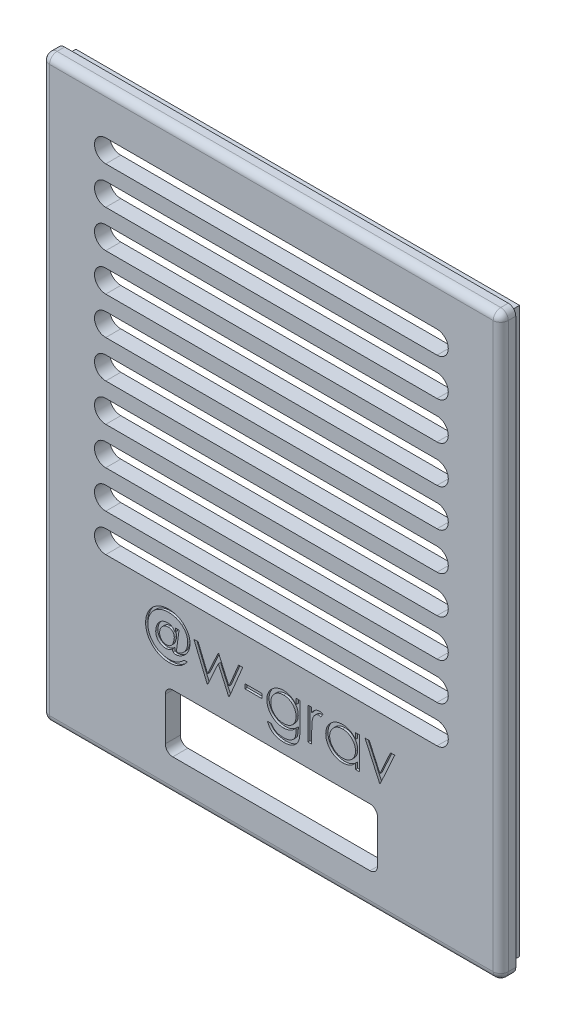
from build123d import *

# Parameters (mm, degrees)
SKETCH_1_W           = 59
SKETCH_1_H           = 75
EXTRUDE_1_DEPTH      = 2
SKETCH_2_W           = 61
SKETCH_2_H           = 77
SKETCH_2_W_2         = 59
SKETCH_2_H_2         = 75
EXTRUDE_1_2_DEPTH    = 2
FILLET_1_R           = 1
EXTRUDE_2_DEPTH      = 1.5
EXTRUDE_2_DEPTH_BACK = 1
SKETCH_5_W           = 59
SKETCH_5_H           = 75
SKETCH_5_W_2         = 58.2
SKETCH_5_H_2         = 74.2
FILLET_2_R           = 1
CUT_EXTRUDE_1_REACH  = 51.158
SKETCH_7_W           = 2.238782052
SKETCH_7_H           = 0.597008547
CUT_EXTRUDE_2_DEPTH  = 0.3


with BuildPart() as part:
    # Эскиз1 → Extrude 1 (new body)
    with BuildSketch(Plane.XY):
        Rectangle(SKETCH_1_W, SKETCH_1_H)
    extrude(amount=EXTRUDE_1_DEPTH)

    # Эскиз2 → Extrude 1 2 (add)
    with BuildSketch(Plane.XY.offset(2)):
        Rectangle(SKETCH_2_W, SKETCH_2_H)
        Rectangle(SKETCH_2_W_2, SKETCH_2_H_2, mode=Mode.SUBTRACT)
    extrude(amount=-EXTRUDE_1_2_DEPTH)

    # Скругление1
    fillet_1_edges = [part.edges().sort_by_distance(p)[0] for p in [
        (30.5, 38.5, 1),
        (30.5, -38.5, 1),
        (-30.5, -38.5, 1),
        (-30.5, 38.5, 1),
    ]]
    fillet(fillet_1_edges, radius=FILLET_1_R)

    # Эскиз5 → Вытянуть-Тонкостенный2 (add, two sides: drawn at the far end of the back side and taken through both)
    with BuildSketch(Plane(origin=(0, 0, 0), x_dir=(-1, 0, 0), z_dir=(0, 0, -1)).offset(-EXTRUDE_2_DEPTH_BACK)):
        Rectangle(SKETCH_5_W, SKETCH_5_H)
        Rectangle(SKETCH_5_W_2, SKETCH_5_H_2, mode=Mode.SUBTRACT)
    extrude(amount=EXTRUDE_2_DEPTH + EXTRUDE_2_DEPTH_BACK)

    # Скругление2
    fillet_2_edges = [part.edges().sort_by_distance(p)[0] for p in [
        (-30.5, 0, 2),
        (30.5, 0, 2),
        (0, 38.5, 2),
        (0, -38.5, 2),
        (-30.207106781, 38.207106781, 2),
        (30.207106781, 38.207106781, 2),
        (30.207106781, -38.207106781, 2),
        (-30.207106781, -38.207106781, 2),
    ]]
    fillet(fillet_2_edges, radius=FILLET_2_R)

    # Эскиз6 → Вырез-Вытянуть1 (cut, up to next)
    with BuildSketch(Plane(origin=(0, 0, 0), x_dir=(-1, 0, 0), z_dir=(0, 0, -1)), mode=Mode.PRIVATE) as cut_extrude_1_sk1:
        with BuildLine():
            Line((-22.027798739, 32.774370454), (22.027798739, 32.774370454))
            ThreePointArc((22.027798739, 32.774370454), (23.524833605, 31.277335588), (22.027798739, 29.780300723))
            Line((22.027798739, 29.780300723), (-22.027798739, 29.780300723))
            ThreePointArc((-22.027798739, 29.780300723), (-23.524833605, 31.277335588), (-22.027798739, 32.774370454))
        make_face()
    cut_extrude_1_tool1 = extrude(cut_extrude_1_sk1.sketch, amount=-CUT_EXTRUDE_1_REACH, mode=Mode.PRIVATE) & part.part
    # Эскиз6 → Вырез-Вытянуть1 (cut, up to next)
    with BuildSketch(Plane(origin=(0, 0, 0), x_dir=(-1, 0, 0), z_dir=(0, 0, -1)), mode=Mode.PRIVATE) as cut_extrude_1_sk2:
        with BuildLine():
            Line((-22.027798739, 27.774370454), (22.027798739, 27.774370454))
            ThreePointArc((22.027798739, 27.774370454), (23.524833605, 26.277335588), (22.027798739, 24.780300723))
            Line((22.027798739, 24.780300723), (-22.027798739, 24.780300723))
            ThreePointArc((-22.027798739, 24.780300723), (-23.524833605, 26.277335588), (-22.027798739, 27.774370454))
        make_face()
    cut_extrude_1_tool2 = extrude(cut_extrude_1_sk2.sketch, amount=-CUT_EXTRUDE_1_REACH, mode=Mode.PRIVATE) & part.part
    # Эскиз6 → Вырез-Вытянуть1 (cut, up to next)
    with BuildSketch(Plane(origin=(0, 0, 0), x_dir=(-1, 0, 0), z_dir=(0, 0, -1)), mode=Mode.PRIVATE) as cut_extrude_1_sk3:
        with BuildLine():
            Line((-22.027798739, 22.774370454), (22.027798739, 22.774370454))
            ThreePointArc((22.027798739, 22.774370454), (23.524833605, 21.277335588), (22.027798739, 19.780300723))
            Line((22.027798739, 19.780300723), (-22.027798739, 19.780300723))
            ThreePointArc((-22.027798739, 19.780300723), (-23.524833605, 21.277335588), (-22.027798739, 22.774370454))
        make_face()
    cut_extrude_1_tool3 = extrude(cut_extrude_1_sk3.sketch, amount=-CUT_EXTRUDE_1_REACH, mode=Mode.PRIVATE) & part.part
    # Эскиз6 → Вырез-Вытянуть1 (cut, up to next)
    with BuildSketch(Plane(origin=(0, 0, 0), x_dir=(-1, 0, 0), z_dir=(0, 0, -1)), mode=Mode.PRIVATE) as cut_extrude_1_sk4:
        with BuildLine():
            Line((-22.027798739, 17.774370454), (22.027798739, 17.774370454))
            ThreePointArc((22.027798739, 17.774370454), (23.524833605, 16.277335588), (22.027798739, 14.780300723))
            Line((22.027798739, 14.780300723), (-22.027798739, 14.780300723))
            ThreePointArc((-22.027798739, 14.780300723), (-23.524833605, 16.277335588), (-22.027798739, 17.774370454))
        make_face()
    cut_extrude_1_tool4 = extrude(cut_extrude_1_sk4.sketch, amount=-CUT_EXTRUDE_1_REACH, mode=Mode.PRIVATE) & part.part
    # Эскиз6 → Вырез-Вытянуть1 (cut, up to next)
    with BuildSketch(Plane(origin=(0, 0, 0), x_dir=(-1, 0, 0), z_dir=(0, 0, -1)), mode=Mode.PRIVATE) as cut_extrude_1_sk5:
        with BuildLine():
            Line((-22.027798739, 12.774370454), (22.027798739, 12.774370454))
            ThreePointArc((22.027798739, 12.774370454), (23.524833605, 11.277335588), (22.027798739, 9.780300723))
            Line((22.027798739, 9.780300723), (-22.027798739, 9.780300723))
            ThreePointArc((-22.027798739, 9.780300723), (-23.524833605, 11.277335588), (-22.027798739, 12.774370454))
        make_face()
    cut_extrude_1_tool5 = extrude(cut_extrude_1_sk5.sketch, amount=-CUT_EXTRUDE_1_REACH, mode=Mode.PRIVATE) & part.part
    # Эскиз6 → Вырез-Вытянуть1 (cut, up to next)
    with BuildSketch(Plane(origin=(0, 0, 0), x_dir=(-1, 0, 0), z_dir=(0, 0, -1)), mode=Mode.PRIVATE) as cut_extrude_1_sk6:
        with BuildLine():
            Line((-22.027798739, 7.774370454), (22.027798739, 7.774370454))
            ThreePointArc((22.027798739, 7.774370454), (23.524833605, 6.277335588), (22.027798739, 4.780300723))
            Line((22.027798739, 4.780300723), (-22.027798739, 4.780300723))
            ThreePointArc((-22.027798739, 4.780300723), (-23.524833605, 6.277335588), (-22.027798739, 7.774370454))
        make_face()
    cut_extrude_1_tool6 = extrude(cut_extrude_1_sk6.sketch, amount=-CUT_EXTRUDE_1_REACH, mode=Mode.PRIVATE) & part.part
    # Эскиз6 → Вырез-Вытянуть1 (cut, up to next)
    with BuildSketch(Plane(origin=(0, 0, 0), x_dir=(-1, 0, 0), z_dir=(0, 0, -1)), mode=Mode.PRIVATE) as cut_extrude_1_sk7:
        with BuildLine():
            Line((-22.027798739, 2.774370454), (22.027798739, 2.774370454))
            ThreePointArc((22.027798739, 2.774370454), (23.524833605, 1.277335588), (22.027798739, -0.219699277))
            Line((22.027798739, -0.219699277), (-22.027798739, -0.219699277))
            ThreePointArc((-22.027798739, -0.219699277), (-23.524833605, 1.277335588), (-22.027798739, 2.774370454))
        make_face()
    cut_extrude_1_tool7 = extrude(cut_extrude_1_sk7.sketch, amount=-CUT_EXTRUDE_1_REACH, mode=Mode.PRIVATE) & part.part
    # Эскиз6 → Вырез-Вытянуть1 (cut, up to next)
    with BuildSketch(Plane(origin=(0, 0, 0), x_dir=(-1, 0, 0), z_dir=(0, 0, -1)), mode=Mode.PRIVATE) as cut_extrude_1_sk8:
        with BuildLine():
            Line((-22.027798739, -2.225629546), (22.027798739, -2.225629546))
            ThreePointArc((22.027798739, -2.225629546), (23.524833605, -3.722664412), (22.027798739, -5.219699277))
            Line((22.027798739, -5.219699277), (-22.027798739, -5.219699277))
            ThreePointArc((-22.027798739, -5.219699277), (-23.524833605, -3.722664412), (-22.027798739, -2.225629546))
        make_face()
    cut_extrude_1_tool8 = extrude(cut_extrude_1_sk8.sketch, amount=-CUT_EXTRUDE_1_REACH, mode=Mode.PRIVATE) & part.part
    # Эскиз6 → Вырез-Вытянуть1 (cut, up to next)
    with BuildSketch(Plane(origin=(0, 0, 0), x_dir=(-1, 0, 0), z_dir=(0, 0, -1)), mode=Mode.PRIVATE) as cut_extrude_1_sk9:
        with BuildLine():
            Line((-22.027798739, -7.225629546), (22.027798739, -7.225629546))
            ThreePointArc((22.027798739, -7.225629546), (23.524833605, -8.722664412), (22.027798739, -10.219699277))
            Line((22.027798739, -10.219699277), (-22.027798739, -10.219699277))
            ThreePointArc((-22.027798739, -10.219699277), (-23.524833605, -8.722664412), (-22.027798739, -7.225629546))
        make_face()
    cut_extrude_1_tool9 = extrude(cut_extrude_1_sk9.sketch, amount=-CUT_EXTRUDE_1_REACH, mode=Mode.PRIVATE) & part.part
    # Эскиз6 → Вырез-Вытянуть1 (cut, up to next)
    with BuildSketch(Plane(origin=(0, 0, 0), x_dir=(-1, 0, 0), z_dir=(0, 0, -1)), mode=Mode.PRIVATE) as cut_extrude_1_sk10:
        with BuildLine():
            Line((-22.027798739, -12.225629546), (22.027798739, -12.225629546))
            ThreePointArc((22.027798739, -12.225629546), (23.524833605, -13.722664412), (22.027798739, -15.219699277))
            Line((22.027798739, -15.219699277), (-22.027798739, -15.219699277))
            ThreePointArc((-22.027798739, -15.219699277), (-23.524833605, -13.722664412), (-22.027798739, -12.225629546))
        make_face()
    cut_extrude_1_tool10 = extrude(cut_extrude_1_sk10.sketch, amount=-CUT_EXTRUDE_1_REACH, mode=Mode.PRIVATE) & part.part
    # Эскиз6 → Вырез-Вытянуть1 (cut, up to next)
    with BuildSketch(Plane(origin=(0, 0, 0), x_dir=(-1, 0, 0), z_dir=(0, 0, -1)), mode=Mode.PRIVATE) as cut_extrude_1_sk11:
        with BuildLine():
            Line((-13.114900163, -34.057543196), (13.114900163, -34.057543196))
            ThreePointArc((13.114900163, -34.057543196), (13.822006944, -33.764649977), (14.114900163, -33.057543196))
            Line((14.114900163, -33.057543196), (14.114900163, -27.358506744))
            ThreePointArc((14.114900163, -27.358506744), (13.822006944, -26.651399962), (13.114900163, -26.358506744))
            Line((13.114900163, -26.358506744), (-13.114900163, -26.358506744))
            ThreePointArc((-13.114900163, -26.358506744), (-13.822006944, -26.651399962), (-14.114900163, -27.358506744))
            Line((-14.114900163, -27.358506744), (-14.114900163, -33.057543196))
            ThreePointArc((-14.114900163, -33.057543196), (-13.822006944, -33.764649977), (-13.114900163, -34.057543196))
        make_face()
    cut_extrude_1_tool11 = extrude(cut_extrude_1_sk11.sketch, amount=-CUT_EXTRUDE_1_REACH, mode=Mode.PRIVATE) & part.part
    add(cut_extrude_1_tool1.solids().sort_by_distance((0, 31.277336, 0))[0], mode=Mode.SUBTRACT)
    add(cut_extrude_1_tool2.solids().sort_by_distance((0, 26.277336, 0))[0], mode=Mode.SUBTRACT)
    add(cut_extrude_1_tool3.solids().sort_by_distance((0, 21.277336, 0))[0], mode=Mode.SUBTRACT)
    add(cut_extrude_1_tool4.solids().sort_by_distance((0, 16.277336, 0))[0], mode=Mode.SUBTRACT)
    add(cut_extrude_1_tool5.solids().sort_by_distance((0, 11.277336, 0))[0], mode=Mode.SUBTRACT)
    add(cut_extrude_1_tool6.solids().sort_by_distance((0, 6.277336, 0))[0], mode=Mode.SUBTRACT)
    add(cut_extrude_1_tool7.solids().sort_by_distance((0, 1.277336, 0))[0], mode=Mode.SUBTRACT)
    add(cut_extrude_1_tool8.solids().sort_by_distance((0, -3.722664, 0))[0], mode=Mode.SUBTRACT)
    add(cut_extrude_1_tool9.solids().sort_by_distance((0, -8.722664, 0))[0], mode=Mode.SUBTRACT)
    add(cut_extrude_1_tool10.solids().sort_by_distance((0, -13.722664, 0))[0], mode=Mode.SUBTRACT)
    add(cut_extrude_1_tool11.solids().sort_by_distance((0, -30.208025, 0))[0], mode=Mode.SUBTRACT)

    # Эскиз7 → Вырез-Вытянуть2 (cut)
    # profile 1 of 7: a face of its own
    with BuildSketch(Plane.XY.offset(2)):
        with BuildLine():
            Line((-11.587119044, -22.170419918), (-11.169679474, -22.170419918))
            add(Edge.make_bspline(
                [(-11.169679474, -22.170419918), (-11.212860723, -22.222417441), (-11.297021828, -22.323761636), (-11.425661244, -22.466598512), (-11.549729907, -22.599572254), (-11.673909454, -22.717692179), (-11.793453843, -22.826370905), (-11.912810805, -22.920039979), (-12.027986482, -23.004156283), (-12.106451637, -23.052048416), (-12.144482492, -23.075260997)],
                knots=[0, 0, 0, 0, 1.213390222, 2.364921437, 3.45091939, 4.477489221, 5.441250277, 6.350193595, 7.200364195, 8, 8, 8, 8], degree=3))
            add(Edge.make_bspline(
                [(-12.144482492, -23.075260997), (-12.19808513, -23.104492219), (-12.305350173, -23.162987255), (-12.474041681, -23.235342224), (-12.647242443, -23.299441331), (-12.826695009, -23.350146156), (-13.011285179, -23.390060455), (-13.201430432, -23.417589663), (-13.396833178, -23.435857412), (-13.529298391, -23.437987431), (-13.596192729, -23.43906308)],
                knots=[0, 0, 0, 0, 0.967652149, 1.936383228, 2.907366375, 3.894489712, 4.890576983, 5.899923271, 6.939470695, 8, 8, 8, 8], degree=3))
            add(Edge.make_bspline(
                [(-13.596192729, -23.43906308), (-13.667375097, -23.438184518), (-13.808471145, -23.436443051), (-14.017463421, -23.415176078), (-14.222449898, -23.384426399), (-14.423153861, -23.339342375), (-14.620776699, -23.284311699), (-14.81308137, -23.21344821), (-15.001725482, -23.131734828), (-15.185356291, -23.037756468), (-15.36130741, -22.931865216), (-15.529358653, -22.817886217), (-15.685301679, -22.692257122), (-15.832917227, -22.559171533), (-15.970873916, -22.417275786), (-16.096989068, -22.264533548), (-16.213836692, -22.103302155), (-16.320908827, -21.933671871), (-16.416023972, -21.757034203), (-16.499046072, -21.575949988), (-16.569728343, -21.390691022), (-16.626242066, -21.201135597), (-16.671250899, -21.007647794), (-16.701848177, -20.810400078), (-16.723220151, -20.609182837), (-16.724950354, -20.473511308), (-16.725823471, -20.405046988)],
                knots=[0, 0, 0, 0, 1.054671765, 2.09054602, 3.110664614, 4.125466063, 5.137598463, 6.149074806, 7.160485519, 8.183382118, 9.204004889, 10.202734905, 11.190638985, 12.169548661, 13.14737277, 14.121047053, 15.102868243, 16.097051703, 17.092036063, 18.074229033, 19.047903316, 20.028472937, 21.00393517, 21.98990556, 22.985640179, 24, 24, 24, 24], degree=3))
            add(Edge.make_bspline(
                [(-16.725823471, -20.405046988), (-16.724256426, -20.335830953), (-16.721134436, -20.197933378), (-16.702895794, -19.992869353), (-16.669271755, -19.791796099), (-16.625833482, -19.593910056), (-16.566725348, -19.400728319), (-16.496884045, -19.210275377), (-16.412606122, -19.024493946), (-16.31718403, -18.842457999), (-16.21065404, -18.667450519), (-16.093922852, -18.501398882), (-15.96742359, -18.345788237), (-15.832189012, -18.200207528), (-15.688450457, -18.063682238), (-15.533790218, -17.939673551), (-15.371571022, -17.822954336), (-15.198970387, -17.719044827), (-15.020479699, -17.624725456), (-14.836989274, -17.542982562), (-14.649738961, -17.473651656), (-14.457862691, -17.41799347), (-14.26209868, -17.373356389), (-14.061868418, -17.342027462), (-13.857766663, -17.322784636), (-13.720222992, -17.320749681), (-13.650996248, -17.319725474)],
                knots=[0, 0, 0, 0, 1.027058365, 2.046185658, 3.051117553, 4.050025228, 5.049781473, 6.046005589, 7.057797166, 8.07411433, 9.093779891, 10.095330734, 11.083325814, 12.066732605, 13.041716928, 14.021600531, 15.005700308, 16.004591337, 17.008016425, 17.999304607, 18.982711398, 19.968128194, 20.961410433, 21.95973534, 22.973119735, 24, 24, 24, 24], degree=3))
            add(Edge.make_bspline(
                [(-13.650996248, -17.319725474), (-13.55371721, -17.321864614), (-13.362784522, -17.326063173), (-13.082213029, -17.362151981), (-12.813281053, -17.420156741), (-12.555404315, -17.501300893), (-12.310645562, -17.609108855), (-12.075795445, -17.737037875), (-11.854195134, -17.891173832), (-11.645522878, -18.064526749), (-11.45663157, -18.254441669), (-11.287883674, -18.452278573), (-11.147897076, -18.660315794), (-11.030134493, -18.87444594), (-10.942334878, -19.098318165), (-10.877199068, -19.328554371), (-10.83755503, -19.566854663), (-10.832778752, -19.728599319), (-10.830364069, -19.810370506)],
                knots=[0, 0, 0, 0, 1.11831066, 2.194944194, 3.246979174, 4.27888224, 5.297750955, 6.317971723, 7.349497193, 8.396773963, 9.433428718, 10.426349215, 11.382158292, 12.312128617, 13.230936323, 14.140829506, 15.060082842, 16, 16, 16, 16], degree=3))
            add(Edge.make_bspline(
                [(-10.830364069, -19.810370506), (-10.831112069, -19.869488256), (-10.832586036, -19.985982365), (-10.848665734, -20.157618082), (-10.872190508, -20.323357092), (-10.908128006, -20.482783904), (-10.951183791, -20.63644503), (-11.007366094, -20.783159189), (-11.07055847, -20.92453161), (-11.145806505, -21.058391931), (-11.228650288, -21.185576021), (-11.318616652, -21.305939544), (-11.415257423, -21.419233401), (-11.51965181, -21.524913639), (-11.631743686, -21.622294104), (-11.750008306, -21.714083545), (-11.875428766, -21.798003069), (-11.963783866, -21.847242715), (-12.008056711, -21.871915645)],
                knots=[0, 0, 0, 0, 1.133597158, 2.233802705, 3.30396869, 4.342264069, 5.366329644, 6.361939563, 7.352848959, 8.334034895, 9.303853874, 10.262605972, 11.214375925, 12.158023099, 13.109033576, 14.060423866, 15.02812001, 16, 16, 16, 16], degree=3))
            add(Edge.make_bspline(
                [(-12.008056711, -21.871915645), (-12.073911063, -21.905918487), (-12.198185021, -21.97008536), (-12.383671779, -22.040575505), (-12.554286435, -22.086236969), (-12.664298568, -22.092744926), (-12.715838328, -22.09579385)],
                knots=[0, 0, 0, 0, 1.186206281, 2.23849367, 3.174749084, 4, 4, 4, 4], degree=3))
            add(Edge.make_bspline(
                [(-12.715838328, -22.09579385), (-12.749433769, -22.094364137), (-12.81410468, -22.091611952), (-12.905981348, -22.066584436), (-12.987272226, -22.024622102), (-13.031068684, -21.984139329), (-13.052821668, -21.964032198)],
                knots=[0, 0, 0, 0, 1.082052135, 2.082940295, 3.047827814, 4, 4, 4, 4], degree=3))
            add(Edge.make_bspline(
                [(-13.052821668, -21.964032198), (-13.067895628, -21.945232353), (-13.100097587, -21.90507092), (-13.128429778, -21.825516335), (-13.148696518, -21.730709935), (-13.150802463, -21.661013062), (-13.151934415, -21.623550761)],
                knots=[0, 0, 0, 0, 0.793528208, 1.695185748, 2.761154694, 4, 4, 4, 4], degree=3))
            add(Edge.make_bspline(
                [(-13.151934415, -21.623550761), (-13.176511352, -21.651444837), (-13.226288904, -21.707940849), (-13.316244655, -21.782159373), (-13.418669538, -21.849033107), (-13.53179302, -21.908827917), (-13.651854215, -21.959695685), (-13.777148284, -21.993447842), (-13.904262316, -22.017686782), (-13.990195642, -22.020002193), (-14.033454848, -22.021167781)],
                knots=[0, 0, 0, 0, 0.894537205, 1.811774761, 2.798735569, 3.837640279, 4.891504278, 5.932137932, 6.959029326, 8, 8, 8, 8], degree=3))
            add(Edge.make_bspline(
                [(-14.033454848, -22.021167781), (-14.08132937, -22.020148722), (-14.175077914, -22.018153186), (-14.312232019, -21.999523609), (-14.44354319, -21.972883596), (-14.567832395, -21.930521882), (-14.687006017, -21.880500448), (-14.798332196, -21.816110699), (-14.904543424, -21.742609773), (-15.00260389, -21.656543013), (-15.092358479, -21.561795645), (-15.169691142, -21.458206123), (-15.235752672, -21.347800973), (-15.289277109, -21.229538756), (-15.331309229, -21.104106928), (-15.3619223, -20.971424594), (-15.379283916, -20.831114614), (-15.381449042, -20.735081387), (-15.38255424, -20.686060777)],
                knots=[0, 0, 0, 0, 1.076938101, 2.1088749, 3.110935573, 4.087505955, 5.059323376, 6.01530039, 6.976387481, 7.962317429, 8.946382585, 9.908703191, 10.865920305, 11.83683164, 12.824467887, 13.83886383, 14.896837935, 16, 16, 16, 16], degree=3))
            add(Edge.make_bspline(
                [(-15.38255424, -20.686060777), (-15.381152965, -20.632360949), (-15.378371355, -20.525763782), (-15.357802822, -20.367807858), (-15.325438246, -20.213189446), (-15.278933247, -20.06232725), (-15.21682385, -19.916177346), (-15.145499754, -19.772053201), (-15.057642957, -19.632787768), (-14.959229591, -19.49759072), (-14.848310573, -19.372251154), (-14.726698509, -19.261233348), (-14.593694094, -19.168989286), (-14.451722688, -19.09201912), (-14.298618276, -19.033799994), (-14.135893904, -18.992232467), (-13.963203623, -18.965530822), (-13.844658736, -18.962864851), (-13.783923932, -18.961498978)],
                knots=[0, 0, 0, 0, 0.982156527, 1.949635761, 2.909086418, 3.86940613, 4.832039489, 5.811438195, 6.80782758, 7.84029968, 8.867740389, 9.864510254, 10.844863476, 11.821496572, 12.811854966, 13.832804459, 14.889667883, 16, 16, 16, 16], degree=3))
            add(Edge.make_bspline(
                [(-13.783923932, -18.961498978), (-13.731361127, -18.9629821), (-13.629896641, -18.965845043), (-13.484170188, -18.990070982), (-13.351907827, -19.032352164), (-13.230703202, -19.091740263), (-13.118206429, -19.17293907), (-13.010485051, -19.276990235), (-12.907012726, -19.40616752), (-12.845081598, -19.503821767), (-12.812619011, -19.555009428)],
                knots=[0, 0, 0, 0, 1.048525916, 2.024019497, 2.936514309, 3.810654959, 4.706011411, 5.693488602, 6.790990403, 8, 8, 8, 8], degree=3))
            Line((-12.812619011, -19.555009428), (-12.728664684, -19.036125046))
            Line((-12.728664684, -19.036125046), (-12.277410177, -19.036125046))
            Line((-12.277410177, -19.036125046), (-12.607397323, -21.470800527))
            add(Edge.make_bspline(
                [(-12.607397323, -21.470800527), (-12.609257413, -21.488688311), (-12.61253366, -21.520194745), (-12.617831927, -21.561291824), (-12.619920766, -21.590118686), (-12.621001805, -21.605283042), (-12.62138971, -21.610724405)],
                knots=[0, 0, 0, 0, 1.534509141, 2.702789396, 3.534527252, 4, 4, 4, 4], degree=3))
            add(Edge.make_bspline(
                [(-12.62138971, -21.610724405), (-12.618828156, -21.627145731), (-12.613470905, -21.661489397), (-12.568156086, -21.69870877), (-12.507488125, -21.719729296), (-12.46110681, -21.721632754), (-12.435990572, -21.722663508)],
                knots=[0, 0, 0, 0, 0.807623339, 1.689068618, 2.748592994, 4, 4, 4, 4], degree=3))
            add(Edge.make_bspline(
                [(-12.435990572, -21.722663508), (-12.416867557, -21.72212908), (-12.377040407, -21.721016036), (-12.31637152, -21.706429819), (-12.25119918, -21.687092369), (-12.182924412, -21.656739214), (-12.109312328, -21.62107552), (-12.031836794, -21.576172216), (-11.951120105, -21.522345421), (-11.836996938, -21.441837684), (-11.699535123, -21.326488011), (-11.553393024, -21.166183067), (-11.424304661, -20.989216317), (-11.319703943, -20.792622251), (-11.233480164, -20.58283125), (-11.173906116, -20.359809861), (-11.134525472, -20.126206687), (-11.130777418, -19.966396198), (-11.128868343, -19.884996574)],
                knots=[0, 0, 0, 0, 0.375176303, 0.781372735, 1.22132254, 1.711029584, 2.247629175, 2.82965315, 3.46978829, 4.154749159, 5.575568552, 6.987253401, 8.410496035, 9.870664801, 11.355111217, 12.860557022, 14.400921749, 16, 16, 16, 16], degree=3))
            add(Edge.make_bspline(
                [(-11.128868343, -19.884996574), (-11.130809949, -19.805933141), (-11.134629875, -19.650383303), (-11.173728093, -19.422862705), (-11.234200656, -19.205787001), (-11.318305812, -18.998500548), (-11.429497834, -18.80261964), (-11.564073334, -18.616982166), (-11.722726559, -18.441216168), (-11.843636424, -18.336433398), (-11.905445867, -18.282868169)],
                knots=[0, 0, 0, 0, 1.028181886, 2.022850771, 2.99499652, 3.956967163, 4.926424071, 5.919109875, 6.936243457, 8, 8, 8, 8], degree=3))
            add(Edge.make_bspline(
                [(-11.905445867, -18.282868169), (-11.96631552, -18.235292713), (-12.087423442, -18.140635291), (-12.285538035, -18.022282726), (-12.492256959, -17.920582203), (-12.708431039, -17.835926786), (-12.93501924, -17.771766002), (-13.171142524, -17.727082239), (-13.417060637, -17.697859803), (-13.5844472, -17.694543784), (-13.669652765, -17.692855816)],
                knots=[0, 0, 0, 0, 0.97603565, 1.941947129, 2.911228469, 3.886855723, 4.873132026, 5.884210117, 6.922989585, 8, 8, 8, 8], degree=3))
            add(Edge.make_bspline(
                [(-13.669652765, -17.692855816), (-13.733431813, -17.694022423), (-13.859255832, -17.696323918), (-14.045750878, -17.713234519), (-14.22758137, -17.739892781), (-14.405399428, -17.776825581), (-14.578457832, -17.826486296), (-14.747299354, -17.885471857), (-14.911711406, -17.955970783), (-15.070518432, -18.037228863), (-15.223084104, -18.128143095), (-15.368369732, -18.227323492), (-15.505169432, -18.336034022), (-15.633332129, -18.454114357), (-15.75415338, -18.580316831), (-15.865862487, -18.715908934), (-15.970182724, -18.859789313), (-16.065212877, -19.011737491), (-16.149877754, -19.169619329), (-16.22389403, -19.331637012), (-16.286747453, -19.496741241), (-16.338370763, -19.665364134), (-16.378049133, -19.836821473), (-16.405734042, -20.011789056), (-16.424053606, -20.189719352), (-16.426227506, -20.309775896), (-16.427319198, -20.370066019)],
                knots=[0, 0, 0, 0, 1.070829268, 2.112543943, 3.141670701, 4.15543105, 5.159481232, 6.16264015, 7.156713958, 8.160785351, 9.155822772, 10.136979681, 11.112411194, 12.087034534, 13.061045838, 14.043742668, 15.034597664, 16.043240159, 17.050614984, 18.040674398, 19.032173992, 20.014870823, 20.999581089, 21.984550855, 22.987879599, 24, 24, 24, 24], degree=3))
            add(Edge.make_bspline(
                [(-16.427319198, -20.370066019), (-16.426236616, -20.430746696), (-16.424080826, -20.551582689), (-16.405625953, -20.730644933), (-16.378430118, -20.906981849), (-16.336949406, -21.078882901), (-16.28600171, -21.247822199), (-16.222000482, -21.412454738), (-16.149614875, -21.575063023), (-16.062529214, -21.731516215), (-15.967737014, -21.883269897), (-15.862245777, -22.02650169), (-15.74949671, -22.162565095), (-15.625826248, -22.288694564), (-15.494697114, -22.407703646), (-15.353995734, -22.517382191), (-15.205408933, -22.619289238), (-15.048635823, -22.712411911), (-14.884593184, -22.794454394), (-14.716147964, -22.867238495), (-14.543706862, -22.929072068), (-14.366904619, -22.979568228), (-14.185619638, -23.017667448), (-14.000363009, -23.045874109), (-13.811040302, -23.062306176), (-13.683675952, -23.06471782), (-13.619513375, -23.065932739)],
                knots=[0, 0, 0, 0, 1.006371614, 2.004030248, 2.983500133, 3.964094175, 4.934952232, 5.908482978, 6.892484038, 7.885129491, 8.876161175, 9.858872768, 10.83385438, 11.805076354, 12.786602682, 13.769462332, 14.76204496, 15.773854901, 16.79174823, 17.802633252, 18.816249484, 19.828572904, 20.850379654, 21.887191355, 22.935626445, 24, 24, 24, 24], degree=3))
            add(Edge.make_bspline(
                [(-13.619513375, -23.065932739), (-13.526471486, -23.064041023), (-13.343878377, -23.060328565), (-13.077478733, -23.020912211), (-12.823366288, -22.962845037), (-12.621324299, -22.890661254), (-12.464182318, -22.819168417), (-12.344585821, -22.755793753), (-12.223578397, -22.681927163), (-12.099943891, -22.598961786), (-11.973645437, -22.506709922), (-11.845930314, -22.404076947), (-11.715838076, -22.291866698), (-11.630732055, -22.21156892), (-11.587119044, -22.170419918)],
                knots=[0, 0, 0, 0, 1.464360193, 2.873781725, 4.232421021, 5.564556907, 6.243952403, 6.950468897, 7.694825178, 8.475836581, 9.294975113, 10.157327564, 11.055713194, 12, 12, 12, 12], degree=3))
        make_face()
        with BuildLine():
            add(Edge.make_bspline(
                [(-13.930844004, -21.573411371), (-13.888332056, -21.571632517), (-13.803924777, -21.56810061), (-13.679360456, -21.539071619), (-13.559973119, -21.489935693), (-13.443595984, -21.425406647), (-13.336552104, -21.33919457), (-13.238294079, -21.235851404), (-13.15387323, -21.1117398), (-13.109534126, -21.019416255), (-13.086636605, -20.971738695)],
                knots=[0, 0, 0, 0, 0.92782678, 1.842195878, 2.775444063, 3.741029296, 4.738047745, 5.764976969, 6.845793398, 8, 8, 8, 8], degree=3))
            add(Edge.make_bspline(
                [(-13.086636605, -20.971738695), (-13.060355153, -20.906531049), (-13.008461076, -20.7777752), (-12.955897912, -20.578545588), (-12.920940764, -20.379076296), (-12.917129594, -20.245446607), (-12.915229855, -20.178836718)],
                knots=[0, 0, 0, 0, 1.032121943, 2.037977831, 3.02199818, 4, 4, 4, 4], degree=3))
            add(Edge.make_bspline(
                [(-12.915229855, -20.178836718), (-12.917769692, -20.124138072), (-12.922673266, -20.018533335), (-12.964797929, -19.867970174), (-13.034183779, -19.733335478), (-13.132603413, -19.618795152), (-13.25128379, -19.525071118), (-13.389160101, -19.457543855), (-13.543179236, -19.41523765), (-13.651876421, -19.411295578), (-13.708131831, -19.409255388)],
                knots=[0, 0, 0, 0, 1.056278198, 2.039318897, 2.997587872, 3.962995163, 4.937462039, 5.902313093, 6.914357928, 8, 8, 8, 8], degree=3))
            add(Edge.make_bspline(
                [(-13.708131831, -19.409255388), (-13.746673497, -19.410408986), (-13.822551449, -19.412680103), (-13.934219616, -19.429700757), (-14.042271862, -19.456170159), (-14.146136314, -19.494937115), (-14.245914768, -19.544524676), (-14.342199382, -19.603852392), (-14.433156693, -19.676013439), (-14.519953402, -19.75689837), (-14.599890727, -19.845368319), (-14.669080327, -19.941154938), (-14.729348657, -20.041231577), (-14.776793006, -20.148041404), (-14.814484988, -20.259635164), (-14.841546556, -20.376741794), (-14.856289843, -20.499507765), (-14.858864559, -20.58302485), (-14.860171762, -20.625427096)],
                knots=[0, 0, 0, 0, 0.991843502, 1.952667371, 2.901538142, 3.851305344, 4.799965068, 5.76619212, 6.756975177, 7.783491418, 8.818022694, 9.820708532, 10.82114524, 11.819829123, 12.822864372, 13.849575656, 14.908213521, 16, 16, 16, 16], degree=3))
            add(Edge.make_bspline(
                [(-14.860171762, -20.625427096), (-14.859769597, -20.66084967), (-14.858984475, -20.730002927), (-14.845033288, -20.830468683), (-14.826117003, -20.9260728), (-14.796623769, -21.015273888), (-14.76029785, -21.099424074), (-14.715550693, -21.177848261), (-14.663574509, -21.251617451), (-14.601998047, -21.317981293), (-14.53548298, -21.378618591), (-14.46216815, -21.429512641), (-14.386031753, -21.475025402), (-14.30402923, -21.510801569), (-14.217342526, -21.539087203), (-14.125812462, -21.55824745), (-14.02999204, -21.57217383), (-13.964323625, -21.572993487), (-13.930844004, -21.573411371)],
                knots=[0, 0, 0, 0, 1.13569322, 2.217142219, 3.24949719, 4.259300957, 5.225644976, 6.186418313, 7.152118103, 8.114509449, 9.086152063, 10.034456292, 10.973610689, 11.928536492, 12.898897255, 13.894659664, 14.926637794, 16, 16, 16, 16], degree=3))
        make_face(mode=Mode.SUBTRACT)
    # profile 2 of 7: a face of its own
    with BuildSketch(Plane.XY.offset(2)):
        Polygon((-10.307981591, -19.110751115), (-9.747120046, -19.110751115), (-8.479642916, -22.170419918), (-7.090898424, -19.110751115), (-7.002279968, -19.110751115), (-5.643852317, -22.170419918), (-4.364714864, -19.110751115), (-3.815513642, -19.110751115), (-5.593712928, -23.364437012), (-5.702153933, -23.364437012), (-7.061747616, -20.304768209), (-8.449326075, -23.364437012), (-8.546106758, -23.364437012), align=None)
    # profile 3 of 7: a face of its own
    with BuildSketch(Plane.XY.offset(2)):
        with Locations((-2.397618343, -21.125654961)):
            Rectangle(SKETCH_7_W, SKETCH_7_H)
    # profile 4 of 7: a face of its own
    with BuildSketch(Plane.XY.offset(2)):
        with BuildLine():
            Line((3.273962854, -19.110751115), (3.796345332, -19.110751115))
            Line((3.796345332, -19.110751115), (3.796345332, -22.486414676))
            add(Edge.make_bspline(
                [(3.796345332, -22.486414676), (3.795884584, -22.558322914), (3.794995229, -22.697123134), (3.788590697, -22.897822606), (3.775085238, -23.083201322), (3.759770323, -23.254104745), (3.737739773, -23.409740707), (3.710836933, -23.550573615), (3.680509262, -23.676738618), (3.653866115, -23.754446479), (3.641263034, -23.791204841)],
                knots=[0, 0, 0, 0, 1.307562039, 2.523909702, 3.650326591, 4.686913197, 5.643429486, 6.506965704, 7.293745905, 8, 8, 8, 8], degree=3))
            add(Edge.make_bspline(
                [(3.641263034, -23.791204841), (3.622654264, -23.838985436), (3.585993115, -23.933118019), (3.517331175, -24.066555336), (3.44043979, -24.192196177), (3.352617134, -24.309340367), (3.254260345, -24.417399834), (3.14768672, -24.518722247), (3.0308207, -24.611164011), (2.903729103, -24.693130155), (2.769341639, -24.766950053), (2.627735563, -24.830890356), (2.479709379, -24.886582166), (2.323872546, -24.928297244), (2.162668335, -24.964444155), (1.994201059, -24.987968114), (1.819454991, -25.003978829), (1.70063452, -25.005459371), (1.640351576, -25.006210516)],
                knots=[0, 0, 0, 0, 0.981931301, 1.934503488, 2.87077864, 3.801706999, 4.735015492, 5.667491629, 6.616593066, 7.585388521, 8.561939025, 9.551802639, 10.560317337, 11.588439944, 12.640189604, 13.723962949, 14.845264515, 16, 16, 16, 16], degree=3))
            add(Edge.make_bspline(
                [(1.640351576, -25.006210516), (1.552399225, -25.004786099), (1.380604655, -25.002003829), (1.130134209, -24.969588581), (0.892253847, -24.923763034), (0.670106804, -24.854402936), (0.465096893, -24.769523561), (0.27862421, -24.672074574), (0.112362737, -24.560332355), (-0.037521514, -24.43310457), (-0.172800326, -24.281823304), (-0.300072497, -24.103541417), (-0.422577659, -23.895543269), (-0.494371215, -23.742883245), (-0.531966634, -23.662941286)],
                knots=[0, 0, 0, 0, 1.157897085, 2.2616841, 3.32207898, 4.345638746, 5.321241055, 6.241986252, 7.112515963, 7.955008012, 8.825025602, 9.77857164, 10.836726669, 12, 12, 12, 12], degree=3))
            Line((-0.531966634, -23.662941286), (-0.009584155, -23.662941286))
            add(Edge.make_bspline(
                [(-0.009584155, -23.662941286), (0.032429305, -23.729641177), (0.114560446, -23.86003125), (0.268144765, -24.028857296), (0.436460524, -24.173136404), (0.625188045, -24.28940468), (0.8351126, -24.377066083), (1.066360481, -24.439557379), (1.320813424, -24.476970813), (1.497963358, -24.481479954), (1.590212186, -24.483828038)],
                knots=[0, 0, 0, 0, 0.997731894, 1.950442991, 2.880492273, 3.800895997, 4.748200782, 5.754801363, 6.83083817, 8, 8, 8, 8], degree=3))
            add(Edge.make_bspline(
                [(1.590212186, -24.483828038), (1.68129474, -24.481449564), (1.856892789, -24.476864105), (2.109402483, -24.439540682), (2.339899064, -24.377052483), (2.547054541, -24.289559726), (2.72842467, -24.182372562), (2.884775565, -24.062629581), (3.011411414, -23.927617842), (3.096583455, -23.803248576), (3.149527456, -23.692446303), (3.183242116, -23.597063474), (3.210639896, -23.489206962), (3.233557078, -23.369238363), (3.25246799, -23.236986274), (3.264447069, -23.092148301), (3.27310483, -22.935053619), (3.273670232, -22.826132292), (3.273962854, -22.76976053)],
                knots=[0, 0, 0, 0, 1.570740765, 3.028230971, 4.391408896, 5.680370741, 6.894727393, 8.017376726, 9.065722033, 10.075533815, 10.603371122, 11.180248986, 11.817768598, 12.521299649, 13.286540596, 14.121245857, 15.027658897, 16, 16, 16, 16], degree=3))
            Line((3.273962854, -22.76976053), (3.273962854, -22.549380422))
            add(Edge.make_bspline(
                [(3.273962854, -22.549380422), (3.220941519, -22.612481252), (3.115831479, -22.737572989), (2.934309079, -22.901490377), (2.736039994, -23.042664097), (2.52136177, -23.158446516), (2.295532991, -23.251050028), (2.060999591, -23.315815881), (1.819863994, -23.357659191), (1.656461312, -23.362161715), (1.573887733, -23.364437012)],
                knots=[0, 0, 0, 0, 1.012485704, 2.007162095, 2.997754123, 3.998611389, 4.999708251, 5.992315798, 6.98544096, 8, 8, 8, 8], degree=3))
            add(Edge.make_bspline(
                [(1.573887733, -23.364437012), (1.525265033, -23.363580474), (1.428595032, -23.361877534), (1.284978863, -23.346978234), (1.143481991, -23.325360088), (1.004434417, -23.293625837), (0.867635499, -23.252893764), (0.733311301, -23.201975211), (0.600374234, -23.144406973), (0.471240713, -23.076597918), (0.347196874, -23.001156081), (0.229178339, -22.919433426), (0.11780328, -22.831857677), (0.014131762, -22.737565267), (-0.081700229, -22.636692665), (-0.170981614, -22.530315185), (-0.252236036, -22.416947402), (-0.327130851, -22.298656498), (-0.392087277, -22.17465458), (-0.449105452, -22.047630533), (-0.498681332, -21.917855962), (-0.538205458, -21.784896382), (-0.568392488, -21.648835619), (-0.590861283, -21.50989657), (-0.603605468, -21.36765139), (-0.60559274, -21.271821598), (-0.606592702, -21.223601676)],
                knots=[0, 0, 0, 0, 1.028754217, 2.045334182, 3.052854819, 4.056607503, 5.061168794, 6.071104265, 7.095078842, 8.125279047, 9.155117945, 10.165957491, 11.161587969, 12.151493252, 13.128948131, 14.104219989, 15.088194871, 16.07871515, 17.064853787, 18.047899887, 19.02414258, 20.002704429, 20.980574569, 21.971845993, 22.979467364, 24, 24, 24, 24], degree=3))
            add(Edge.make_bspline(
                [(-0.606592702, -21.223601676), (-0.605729279, -21.175366765), (-0.604005777, -21.079083764), (-0.589119446, -20.936258167), (-0.567884731, -20.795345047), (-0.534277287, -20.657796856), (-0.493826615, -20.52204712), (-0.443728245, -20.389098528), (-0.383492999, -20.258910586), (-0.31528988, -20.131386885), (-0.238647645, -20.00823865), (-0.154607316, -19.89127874), (-0.063067437, -19.781367816), (0.034709118, -19.677397052), (0.139916218, -19.580369593), (0.252499437, -19.490520931), (0.371349013, -19.406344985), (0.496833291, -19.32965744), (0.627016043, -19.26183268), (0.758589857, -19.199944587), (0.893297636, -19.150826533), (1.028627918, -19.107547641), (1.166964039, -19.076888156), (1.306609811, -19.053235213), (1.448043318, -19.038824957), (1.542761407, -19.037026178), (1.590212186, -19.036125046)],
                knots=[0, 0, 0, 0, 1.008818848, 2.013730394, 3.001654427, 3.987803273, 4.973046549, 5.963777569, 6.957074694, 7.972068341, 8.987420212, 9.989399531, 10.982630087, 11.977756091, 12.973280677, 13.973972381, 14.989194003, 16.018387222, 17.047741039, 18.059210846, 19.057554164, 20.045176975, 21.029480261, 22.018708529, 23.007435371, 24, 24, 24, 24], degree=3))
            add(Edge.make_bspline(
                [(1.590212186, -19.036125046), (1.668462378, -19.038381323), (1.822982465, -19.042836777), (2.050379144, -19.077796944), (2.269811655, -19.13353394), (2.482518236, -19.213388506), (2.690231598, -19.322404463), (2.892267161, -19.466001008), (3.089209459, -19.64546618), (3.210744851, -19.783092075), (3.273962854, -19.854679734)],
                knots=[0, 0, 0, 0, 0.96728863, 1.910097829, 2.838038873, 3.762875196, 4.71315279, 5.730631239, 6.819562287, 8, 8, 8, 8], degree=3))
            Line((3.273962854, -19.854679734), (3.273962854, -19.110751115))
        make_face()
        with BuildLine():
            add(Edge.make_bspline(
                [(1.632189349, -19.558507525), (1.555802214, -19.561103726), (1.404571885, -19.566243652), (1.182900677, -19.610123943), (0.968898682, -19.678886112), (0.766657273, -19.777245915), (0.577218901, -19.897145498), (0.409121849, -20.042400715), (0.262096054, -20.20828814), (0.137724905, -20.393307896), (0.038718573, -20.592916371), (-0.031369947, -20.80331577), (-0.076689331, -21.021106395), (-0.081691343, -21.169741546), (-0.084210223, -21.244590257)],
                knots=[0, 0, 0, 0, 1.026226791, 2.031711442, 3.026614839, 4.04107745, 5.047145931, 6.032893242, 7.017642609, 8.019221815, 9.021877557, 10.003543541, 10.994637589, 12, 12, 12, 12], degree=3))
            add(Edge.make_bspline(
                [(-0.084210223, -21.244590257), (-0.083003221, -21.301024521), (-0.080629399, -21.412014215), (-0.057805782, -21.574894262), (-0.020916725, -21.730028307), (0.031366343, -21.877425735), (0.096148385, -22.017931995), (0.177627364, -22.150579198), (0.27350642, -22.275485477), (0.383035108, -22.39172699), (0.503736543, -22.497601243), (0.634654069, -22.590631532), (0.775610121, -22.666719338), (0.923137995, -22.732479517), (1.080817311, -22.780508157), (1.246376922, -22.817160746), (1.420988113, -22.838130311), (1.540018732, -22.840729392), (1.600706477, -22.842054533)],
                knots=[0, 0, 0, 0, 1.039728707, 2.044842319, 3.024901384, 3.974314358, 4.923051295, 5.871625912, 6.837440708, 7.820715446, 8.810779094, 9.792721783, 10.773906224, 11.758876063, 12.764959493, 13.806266761, 14.881525401, 16, 16, 16, 16], degree=3))
            add(Edge.make_bspline(
                [(1.600706477, -22.842054533), (1.662180727, -22.840777927), (1.782392972, -22.838281535), (1.957967494, -22.816821788), (2.124331468, -22.782192859), (2.281332352, -22.733026732), (2.429562935, -22.670291868), (2.56735805, -22.590901327), (2.697672285, -22.500488099), (2.81634479, -22.39502788), (2.923654623, -22.278802478), (3.017171743, -22.152332575), (3.096858035, -22.017521212), (3.162845779, -21.874383584), (3.213222937, -21.721807314), (3.247015211, -21.560173822), (3.270642381, -21.390257479), (3.272839205, -21.273826483), (3.273962854, -21.214273417)],
                knots=[0, 0, 0, 0, 1.121943988, 2.193949579, 3.223793937, 4.220241907, 5.192961521, 6.155822191, 7.11847367, 8.083710714, 9.04790392, 10.001595906, 10.949595423, 11.902125208, 12.873731292, 13.87582262, 14.913508608, 16, 16, 16, 16], degree=3))
            add(Edge.make_bspline(
                [(3.273962854, -21.214273417), (3.271735024, -21.136743486), (3.267382628, -20.985277245), (3.226308903, -20.764573251), (3.160084101, -20.557071064), (3.067205633, -20.363426947), (2.950818888, -20.185692708), (2.810635179, -20.027160076), (2.649072078, -19.887624961), (2.466593775, -19.771377608), (2.270269632, -19.677470213), (2.064842119, -19.607018552), (1.85061622, -19.567113721), (1.705417346, -19.561392767), (1.632189349, -19.558507525)],
                knots=[0, 0, 0, 0, 1.070913519, 2.092188694, 3.091357305, 4.074328408, 5.051968682, 6.018948707, 6.99050112, 7.9935919, 9.000589572, 9.992915277, 10.987769056, 12, 12, 12, 12], degree=3))
        make_face(mode=Mode.SUBTRACT)
    # profile 5 of 7: a face of its own
    with BuildSketch(Plane.XY.offset(2)):
        with BuildLine():
            Line((4.84111029, -19.110751115), (5.363492768, -19.110751115))
            Line((5.363492768, -19.110751115), (5.363492768, -19.73691047))
            add(Edge.make_bspline(
                [(5.363492768, -19.73691047), (5.402057882, -19.678609288), (5.475813364, -19.567108733), (5.598404986, -19.41964324), (5.723974216, -19.297547026), (5.853122189, -19.200250102), (5.986798624, -19.127384713), (6.122069721, -19.074010939), (6.261063687, -19.042449857), (6.354466316, -19.038236141), (6.401261532, -19.036125046)],
                knots=[0, 0, 0, 0, 1.2804753, 2.448899062, 3.506932113, 4.484331642, 5.4025378, 6.288909075, 7.142734305, 8, 8, 8, 8], degree=3))
            add(Edge.make_bspline(
                [(6.401261532, -19.036125046), (6.437560791, -19.038105005), (6.512248877, -19.0421789), (6.625310398, -19.07080214), (6.74179933, -19.116500709), (6.816875419, -19.15947546), (6.856014136, -19.181879086)],
                knots=[0, 0, 0, 0, 0.901110191, 1.854092781, 2.881294221, 4, 4, 4, 4], degree=3))
            Line((6.856014136, -19.181879086), (6.569170185, -19.634299626))
            add(Edge.make_bspline(
                [(6.569170185, -19.634299626), (6.544042444, -19.623089921), (6.496345181, -19.601811756), (6.426570742, -19.576629151), (6.362239995, -19.561801134), (6.32125541, -19.559554762), (6.302148784, -19.558507525)],
                knots=[0, 0, 0, 0, 1.180555205, 2.24091978, 3.179933427, 4, 4, 4, 4], degree=3))
            add(Edge.make_bspline(
                [(6.302148784, -19.558507525), (6.260229249, -19.561301587), (6.174725548, -19.567000664), (6.049187637, -19.611802467), (5.927370558, -19.684189086), (5.830625543, -19.764468543), (5.755715987, -19.841881963), (5.702263731, -19.909484128), (5.653231115, -19.985285733), (5.606381356, -20.067990933), (5.563695864, -20.159011879), (5.523856968, -20.2574392), (5.487836216, -20.363386896), (5.467296583, -20.437199254), (5.456775354, -20.475008927)],
                knots=[0, 0, 0, 0, 1.125678352, 2.296057538, 3.5422874, 4.923748041, 5.663163013, 6.437101912, 7.23742474, 8.08941207, 8.991984279, 9.93940061, 10.944477711, 12, 12, 12, 12], degree=3))
            add(Edge.make_bspline(
                [(5.456775354, -20.475008927), (5.448904933, -20.508731798), (5.431472549, -20.583425394), (5.414523051, -20.708737167), (5.397776483, -20.85679199), (5.385974131, -21.028001978), (5.37503422, -21.221939579), (5.368864, -21.43890024), (5.363703182, -21.679106659), (5.363565034, -21.847036625), (5.363492768, -21.93488139)],
                knots=[0, 0, 0, 0, 0.566838948, 1.255505196, 2.06880316, 3.007127437, 4.065329342, 5.249902469, 6.561414163, 8, 8, 8, 8], degree=3))
            Line((5.363492768, -21.93488139), (5.363492768, -23.364437012))
            Line((5.363492768, -23.364437012), (4.84111029, -23.364437012))
            Line((4.84111029, -23.364437012), (4.84111029, -19.110751115))
        make_face()
    # profile 6 of 7: a face of its own
    with BuildSketch(Plane.XY.offset(2)):
        with BuildLine():
            Line((11.70670858, -19.110751115), (11.70670858, -23.364437012))
            Line((11.70670858, -23.364437012), (11.184326102, -23.364437012))
            Line((11.184326102, -23.364437012), (11.184326102, -22.628670619))
            add(Edge.make_bspline(
                [(11.184326102, -22.628670619), (11.125421279, -22.695260277), (11.010467779, -22.825210832), (10.818478205, -22.994983207), (10.614968271, -23.135312392), (10.400925717, -23.248652192), (10.176543829, -23.333789457), (9.942320003, -23.394303105), (9.698158694, -23.433209281), (9.53142948, -23.437094308), (9.446937947, -23.43906308)],
                knots=[0, 0, 0, 0, 1.074387032, 2.096679803, 3.090159297, 4.057316773, 5.018401886, 5.985159533, 6.978961417, 8, 8, 8, 8], degree=3))
            add(Edge.make_bspline(
                [(9.446937947, -23.43906308), (9.371819338, -23.437023507), (9.223682115, -23.433001377), (9.005768281, -23.401797879), (8.796064861, -23.351687785), (8.594373697, -23.282002616), (8.401999903, -23.189566416), (8.217296385, -23.078901983), (8.041220015, -22.947116936), (7.87645461, -22.796460417), (7.724727105, -22.632820183), (7.591577584, -22.458285743), (7.480560854, -22.273611817), (7.387726744, -22.081136559), (7.316219728, -21.879378295), (7.26637072, -21.669034719), (7.235203572, -21.450354536), (7.231183105, -21.301441782), (7.229144478, -21.22593374)],
                knots=[0, 0, 0, 0, 1.033919861, 2.038935746, 3.024066025, 3.998881131, 4.97069526, 5.957263378, 6.95902576, 7.993208707, 9.027059324, 10.027763471, 11.009749337, 11.988697705, 12.965288445, 13.950418724, 14.960734635, 16, 16, 16, 16], degree=3))
            add(Edge.make_bspline(
                [(7.229144478, -21.22593374), (7.231228288, -21.151986367), (7.23534787, -21.005796398), (7.266037332, -20.790793611), (7.317644855, -20.583707884), (7.390069073, -20.385205921), (7.482939562, -20.195047528), (7.59591044, -20.013098215), (7.728989865, -19.838856729), (7.882414404, -19.676420176), (8.048615444, -19.526374702), (8.226414846, -19.395972992), (8.411389755, -19.283353423), (8.60640931, -19.194122583), (8.808586983, -19.121929107), (9.019722654, -19.071981421), (9.238937863, -19.042549091), (9.387769074, -19.03828697), (9.4632624, -19.036125046)],
                knots=[0, 0, 0, 0, 1.020392517, 2.01726096, 2.990465484, 3.961182959, 4.928053699, 5.906110375, 6.912531644, 7.948652711, 8.985773172, 9.998621852, 10.987621588, 11.969261332, 12.953316658, 13.946091881, 14.958173133, 16, 16, 16, 16], degree=3))
            add(Edge.make_bspline(
                [(9.4632624, -19.036125046), (9.550075737, -19.038516164), (9.720312593, -19.043205033), (9.969324533, -19.082225783), (10.204892789, -19.148148329), (10.428835801, -19.237818263), (10.640349394, -19.356976924), (10.837431143, -19.507287406), (11.02214362, -19.687801737), (11.129214176, -19.826454727), (11.184326102, -19.89782293)],
                knots=[0, 0, 0, 0, 1.038897134, 2.037228247, 3.008116434, 3.962042015, 4.918381754, 5.904844433, 6.921570401, 8, 8, 8, 8], degree=3))
            Line((11.184326102, -19.89782293), (11.184326102, -19.110751115))
            Line((11.184326102, -19.110751115), (11.70670858, -19.110751115))
        make_face()
        with BuildLine():
            add(Edge.make_bspline(
                [(9.470258594, -19.558507525), (9.393898677, -19.56122442), (9.243176347, -19.566587139), (9.021911501, -19.608453059), (8.810177168, -19.678111128), (8.609032328, -19.773376385), (8.421654353, -19.893167034), (8.254191189, -20.038058192), (8.105273148, -20.204096655), (7.980028333, -20.390533141), (7.87793009, -20.590400752), (7.806139204, -20.799326157), (7.758792135, -21.013541101), (7.753954988, -21.158833568), (7.751526956, -21.231763902)],
                knots=[0, 0, 0, 0, 1.031046209, 2.035121221, 3.029706178, 4.034933723, 5.034054252, 6.02443088, 7.017295772, 8.038157696, 9.050218397, 10.03989886, 11.016116709, 12, 12, 12, 12], degree=3))
            add(Edge.make_bspline(
                [(7.751526956, -21.231763902), (7.754628451, -21.304258401), (7.760819285, -21.448963247), (7.805308237, -21.66347023), (7.879947741, -21.872444869), (7.981799124, -22.07411345), (8.109336285, -22.261351531), (8.257166579, -22.430555044), (8.426719607, -22.576058562), (8.614528806, -22.697859622), (8.815111347, -22.796252529), (9.026048255, -22.864714908), (9.243374286, -22.908916288), (9.39114418, -22.914079329), (9.465594464, -22.916680602)],
                knots=[0, 0, 0, 0, 0.979072187, 1.954306742, 2.945804271, 3.96968567, 4.997920485, 5.998718438, 6.996577872, 8.005894225, 9.015743152, 10.005417472, 10.995077863, 12, 12, 12, 12], degree=3))
            add(Edge.make_bspline(
                [(9.465594464, -22.916680602), (9.541176327, -22.913919924), (9.691501154, -22.908429209), (9.913422434, -22.866384057), (10.12878489, -22.796918567), (10.33465484, -22.700626805), (10.526436549, -22.581287488), (10.698563376, -22.441575695), (10.844110766, -22.279085995), (10.967500142, -22.100508727), (11.064251401, -21.904742467), (11.134726823, -21.696299771), (11.176393854, -21.475173384), (11.181645459, -21.324058019), (11.184326102, -21.246922322)],
                knots=[0, 0, 0, 0, 1.01762866, 2.023962475, 3.030623092, 4.058876274, 5.077231937, 6.066672613, 7.034107872, 8.005628644, 8.981990164, 9.965428785, 10.961468474, 12, 12, 12, 12], degree=3))
            add(Edge.make_bspline(
                [(11.184326102, -21.246922322), (11.182730102, -21.188152144), (11.179588669, -21.072473836), (11.155589257, -20.902626048), (11.117413028, -20.740085554), (11.063618267, -20.584681463), (10.992951214, -20.437272991), (10.907721299, -20.296801713), (10.806429735, -20.163998218), (10.690707085, -20.040691229), (10.564037099, -19.928221982), (10.430000702, -19.827830501), (10.287009858, -19.745359649), (10.137469262, -19.677104106), (9.981119459, -19.622788829), (9.816688202, -19.586553819), (9.645923268, -19.561673381), (9.529430007, -19.559573921), (9.470258594, -19.558507525)],
                knots=[0, 0, 0, 0, 1.050140795, 2.067009409, 3.05949893, 4.030605086, 5.00011959, 5.97591094, 6.962425594, 7.979863591, 8.993523472, 9.986985069, 10.967611495, 11.937549037, 12.921786183, 13.919465291, 14.943216303, 16, 16, 16, 16], degree=3))
        make_face(mode=Mode.SUBTRACT)
    # profile 7 of 7: a face of its own
    with BuildSketch(Plane.XY.offset(2)):
        Polygon((12.452969264, -19.110751115), (13.018494938, -19.110751115), (14.430560076, -22.207732952), (15.842625213, -19.110751115), (16.408150888, -19.110751115), (14.46787311, -23.364437012), (14.393247042, -23.364437012), align=None)
    extrude(amount=-CUT_EXTRUDE_2_DEPTH, mode=Mode.SUBTRACT)


solid = part.part
